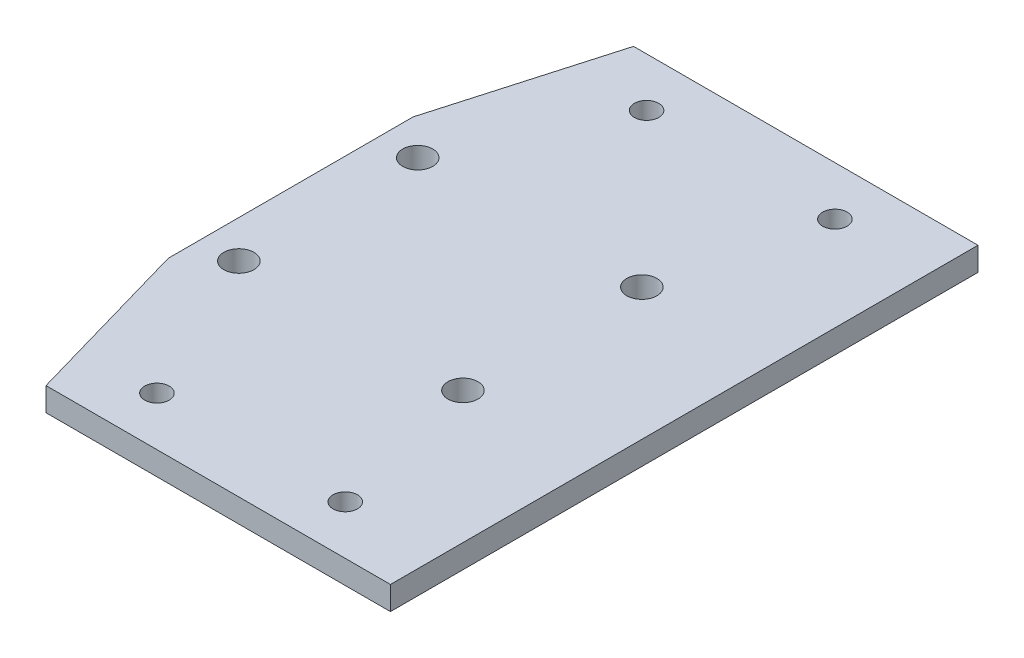
from build123d import *

# Parameters (mm, degrees)
SKETCH1_W           = 57.15
SKETCH1_H           = 79.248
BOSS_EXTRUDE1_DEPTH = 3.175
SKETCH2_R           = 1.651
CUT_EXTRUDE1_DEPTH  = 79.095767635
SKETCH3_R           = 2.032
CUT_EXTRUDE2_DEPTH  = 79.095767635
CUT_EXTRUDE3_DEPTH  = 79.095767635


with BuildPart() as part:
    # Sketch1 → Boss-Extrude1 (new body)
    with BuildSketch(Plane(origin=(0, 0, 0), x_dir=(1, 0, 0), z_dir=(0, 1, 0))):
        with Locations((-26.398757506, -15.754283497)):
            Rectangle(SKETCH1_W, SKETCH1_H)
    extrude(amount=-BOSS_EXTRUDE1_DEPTH)

    # Sketch2 → Cut-Extrude1 (cut, through all)
    with BuildSketch(Plane(origin=(0, 0, 0), x_dir=(1, 0, 0), z_dir=(0, 1, 0))):
        with Locations(Location((-35.923757506, -48.774283497, 0), (0, 0, 270))):
            Circle(SKETCH2_R)
        with Locations(Location((-35.923757506, 17.265716503, 0), (0, 0, 270))):
            Circle(SKETCH2_R)
        with Locations(Location((-10.523757506, -48.774283497, 0), (0, 0, 270))):
            Circle(SKETCH2_R)
        with Locations(Location((-10.523757506, 17.265716503, 0), (0, 0, 270))):
            Circle(SKETCH2_R)
    extrude(amount=-CUT_EXTRUDE1_DEPTH, mode=Mode.SUBTRACT)

    # Sketch3 → Cut-Extrude2 (cut, through all)
    with BuildSketch(Plane(origin=(0, 0, 0), x_dir=(1, 0, 0), z_dir=(0, 1, 0))):
        with Locations(Location((-45.829757506, -3.689283497, 0), (0, 0, 270))):
            Circle(SKETCH3_R)
        with Locations(Location((-15.603757506, -3.689283497, 0), (0, 0, 270))):
            Circle(SKETCH3_R)
        with Locations(Location((-45.829757506, -27.819283497, 0), (0, 0, 270))):
            Circle(SKETCH3_R)
        with Locations(Location((-15.603757506, -27.819283497, 0), (0, 0, 270))):
            Circle(SKETCH3_R)
    extrude(amount=-CUT_EXTRUDE2_DEPTH, mode=Mode.SUBTRACT)

    # Sketch4 → Cut-Extrude3 (cut, through all)
    with BuildSketch(Plane(origin=(0, 0, 0), x_dir=(1, 0, 0), z_dir=(0, 1, 0))):
        Polygon((-50.909757506, -32.264283497), (-50.909757506, 0.755716503), (-40.921106308, 35.590282968), (-90.515991817, 35.590282968), (-90.515991817, -67.098849962), (-50.909757506, -67.098849962), (-40.921106308, -67.098849962), align=None)
    extrude(amount=-CUT_EXTRUDE3_DEPTH, mode=Mode.SUBTRACT)


solid = part.part
